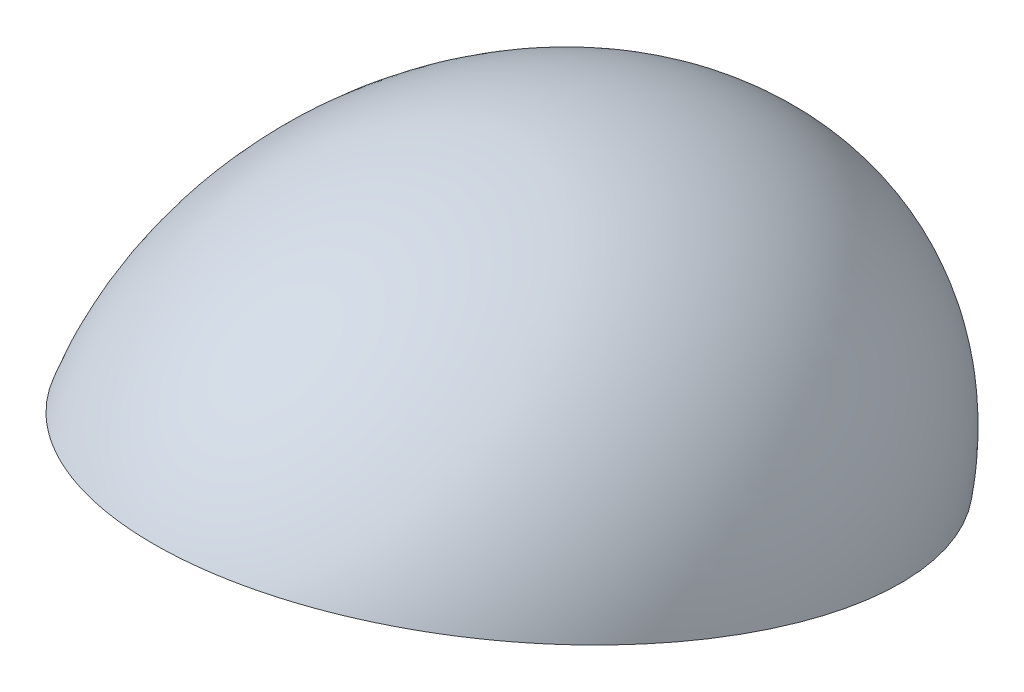
from build123d import *

# Parameters (mm, degrees)
SKETCH4_W          = 545.847856454
SKETCH4_H          = 685.830711664
CUT_EXTRUDE2_DEPTH = 375.200079158


with BuildPart() as part:
    # Sketch1 → Revolve1 (revolve)
    with BuildSketch(Plane(origin=(0, 0, 0), x_dir=(1, 0, 0), z_dir=(0, 1, 0))):
        with BuildLine():
            Line((0, 240), (0, -240))
            add(Edge.make_bspline(
                [(0, 240), (-190, 240), (-190, 0), (-190, -240), (0, -240)],
                knots=[3.141592654, 3.141592654, 3.141592654, 4.71238898, 4.71238898, 6.283185307, 6.283185307, 6.283185307], degree=2, weights=[1, 0.707106781, 1, 0.707106781, 1]))
        make_face()
    revolve(axis=Axis((0, 0, -240), (0, 0, 1)))

    # Sketch4 → Cut-Extrude2 (cut, through all)
    with BuildSketch(Plane(origin=(0, 19.318516526, -5.176380902), x_dir=(1, 0, 0), z_dir=(0, 0.9659258262890718, -0.25881904510250786))):
        Rectangle(SKETCH4_W, SKETCH4_H)
    extrude(amount=-CUT_EXTRUDE2_DEPTH, mode=Mode.SUBTRACT)


solid = part.part
